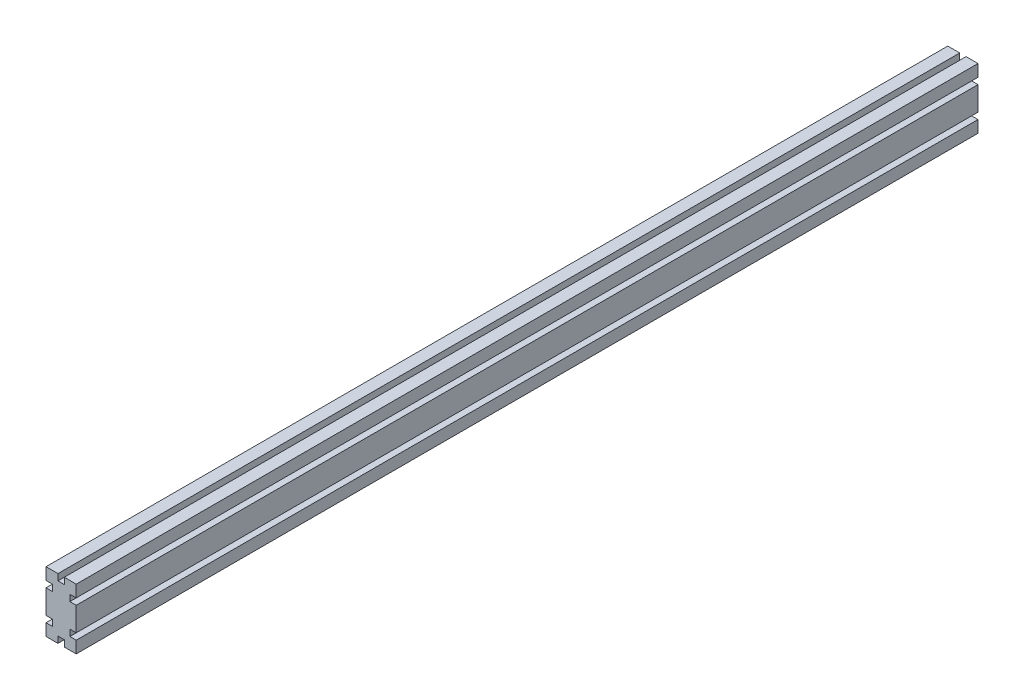
from build123d import *

# Parameters (mm, degrees)
PROFILE_DEPTH = 1136.65


with BuildPart() as part:
    # Sketch1 → Profile (new body)
    with BuildSketch(Plane.XY):
        Polygon((-19.05, -38.1), (-4, -38.1), (-4, -30.1), (4, -30.1), (4, -38.1), (19.05, -38.1), (19.05, -23.05), (11.05, -23.05), (11.05, -15.05), (19.05, -15.05), (19.05, 15.05), (11.05, 15.05), (11.05, 23.05), (19.05, 23.05), (19.05, 38.1), (4, 38.1), (4, 30.1), (-4, 30.1), (-4, 38.1), (-19.05, 38.1), (-19.05, 23.05), (-11.05, 23.05), (-11.05, 15.05), (-19.05, 15.05), (-19.05, -15.05), (-11.05, -15.05), (-11.05, -23.05), (-19.05, -23.05), align=None)
    extrude(amount=PROFILE_DEPTH)


solid = part.part
